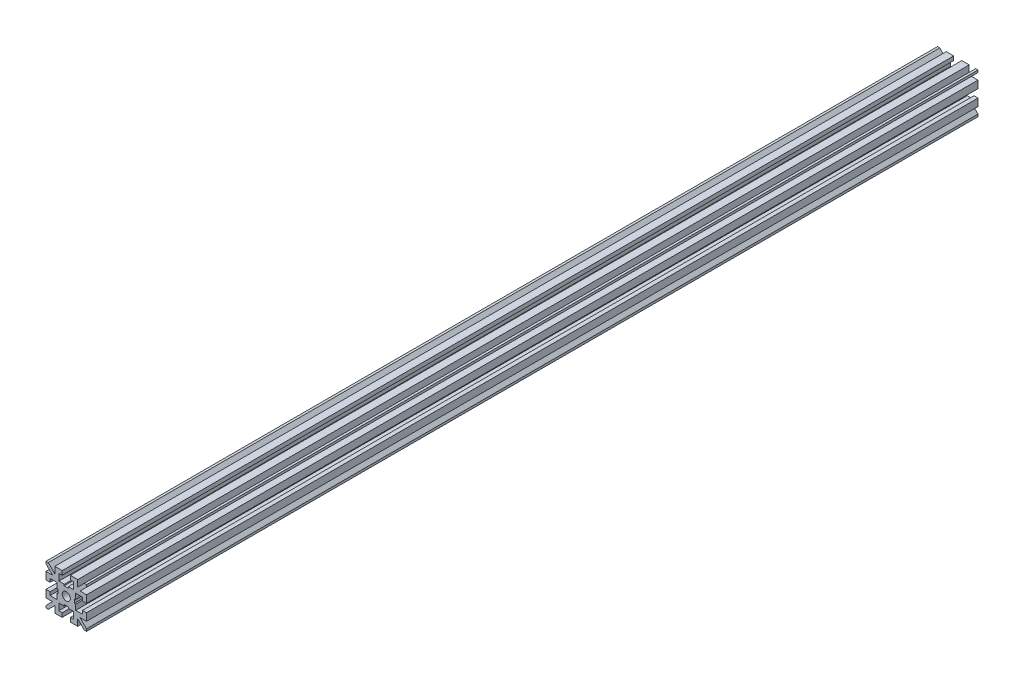
from build123d import *

# Parameters (mm, degrees)
SKETCH1_W           = 15
SKETCH1_H           = 15
BOSS_EXTRUDE1_DEPTH = 330
SKETCH2_R           = 1.5
CUT_EXTRUDE1_DEPTH  = 330
SKETCH3_W           = 3
SKETCH3_H           = 1.5
SKETCH3_W_2         = 1.5
SKETCH3_H_2         = 3
CUT_EXTRUDE2_DEPTH  = 330


with BuildPart() as part:
    # Sketch1 → Boss-Extrude1 (new body)
    with BuildSketch(Plane.XY):
        with Locations((-1.500578266, -3.738353388)):
            Rectangle(SKETCH1_W, SKETCH1_H)
    extrude(amount=BOSS_EXTRUDE1_DEPTH)

    # Sketch2 → Cut-Extrude1 (cut)
    with BuildSketch(Plane.XY.offset(330)):
        with Locations((-1.500578266, -3.738353388)):
            Circle(SKETCH2_R)
        Polygon((1.999421734, -4.488353388), (1.999421734, -6.488353388), (4.499421734, -6.488353388), (4.499421734, -0.988353388), (1.999421734, -0.988353388), (1.999421734, -2.988353388), (1.499421734, -2.988353388), (1.499421734, -4.488353388), align=None)
        Polygon((-4.250578266, -7.238353388), (-4.250578266, -9.738353388), (1.249421734, -9.738353388), (1.249421734, -7.238353388), (-0.750578266, -7.238353388), (-0.750578266, -6.738353388), (-2.250578266, -6.738353388), (-2.250578266, -7.238353388), align=None)
        Polygon((-5.000578266, -0.988353388), (-7.500578266, -0.988353388), (-7.500578266, -6.488353388), (-5.000578266, -6.488353388), (-5.000578266, -4.488353388), (-4.500578266, -4.488353388), (-4.500578266, -2.988353388), (-5.000578266, -2.988353388), align=None)
        Polygon((1.249421734, -0.238353388), (1.249421734, 2.261646612), (-4.250578266, 2.261646612), (-4.250578266, -0.238353388), (-2.250578266, -0.238353388), (-2.250578266, -0.738353388), (-0.750578266, -0.738353388), (-0.750578266, -0.238353388), align=None)
    extrude(amount=-CUT_EXTRUDE1_DEPTH, mode=Mode.SUBTRACT)

    # Sketch3 → Cut-Extrude2 (cut)
    with BuildSketch(Plane.XY.offset(330)):
        Polygon((5.150893596, 3.761646612), (2.749421734, 1.360174749), (2.749421734, 3.761646612), align=None)
        Polygon((5.999421734, 0.511646612), (5.999421734, 2.913118474), (3.597949871, 0.511646612), align=None)
        with Locations((-1.500578266, 3.011646612)):
            Rectangle(SKETCH3_W, SKETCH3_H)
        Polygon((2.749421734, -8.836881526), (2.749421734, -11.238353388), (5.150893596, -11.238353388), align=None)
        Polygon((5.999421734, -10.389825251), (3.597949871, -7.988353388), (5.999421734, -7.988353388), align=None)
        with Locations((5.249421734, -3.738353388)):
            Rectangle(SKETCH3_W_2, SKETCH3_H_2)
        Polygon((-6.599106404, -7.988353388), (-9.000578266, -7.988353388), (-9.000578266, -10.389825251), align=None)
        Polygon((-8.152050129, -11.238353388), (-5.750578266, -8.836881526), (-5.750578266, -11.238353388), align=None)
        with Locations((-1.500578266, -10.488353388)):
            Rectangle(SKETCH3_W, SKETCH3_H)
        Polygon((-5.750578266, 1.360174749), (-5.750578266, 3.761646612), (-8.152050129, 3.761646612), align=None)
        Polygon((-9.000578266, 2.913118474), (-6.599106404, 0.511646612), (-9.000578266, 0.511646612), align=None)
        with Locations((-8.250578266, -3.738353388)):
            Rectangle(SKETCH3_W_2, SKETCH3_H_2)
    extrude(amount=-CUT_EXTRUDE2_DEPTH, mode=Mode.SUBTRACT)


solid = part.part
